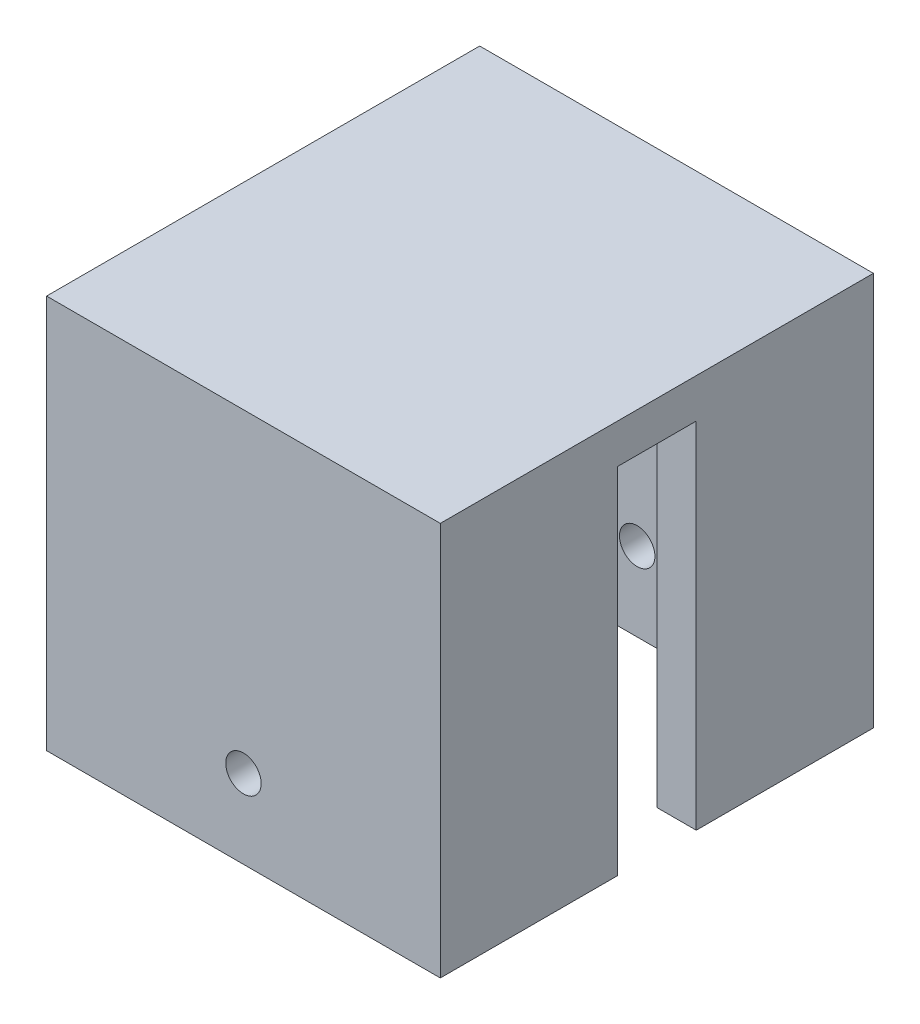
from build123d import *

# Parameters (mm, degrees)
ESBO_O1_W                = 50
ESBO_O1_H                = 50
RESSALTO_EXTRUS_O1_DEPTH = 55
CASCA2_T                 = -5
ESBO_O2_R                = 2.25
CORTE_EXTRUS_O1_DEPTH    = 90.582364336
ESBO_O3_W                = 10
ESBO_O3_H                = 45
CORTE_EXTRUS_O2_DEPTH    = 90.582364336


with BuildPart() as part:
    # Esboço1 → Ressalto-extrusão1 (new body)
    with BuildSketch(Plane.XY):
        with Locations((25, 25)):
            Rectangle(ESBO_O1_W, ESBO_O1_H)
    extrude(amount=RESSALTO_EXTRUS_O1_DEPTH)

    # Casca2
    casca2_openings = [part.faces().sort_by_distance(p)[0] for p in [
        (25, 0, 27.5),
    ]]
    offset(amount=CASCA2_T, openings=casca2_openings, kind=Kind.INTERSECTION)

    # Esboço2 → Corte-extrusão1 (cut, through all)
    with BuildSketch(Plane.XY.offset(55)):
        with Locations((25, 10)):
            Circle(ESBO_O2_R)
    extrude(amount=-CORTE_EXTRUS_O1_DEPTH, mode=Mode.SUBTRACT)

    # Esboço3 → Corte-extrusão2 (cut, through all)
    with BuildSketch(Plane(origin=(50, 0, 0), x_dir=(0, 0, -1), z_dir=(1, 0, 0))):
        with Locations((-27.5, 22.5)):
            Rectangle(ESBO_O3_W, ESBO_O3_H)
    extrude(amount=-CORTE_EXTRUS_O2_DEPTH, mode=Mode.SUBTRACT)


solid = part.part
